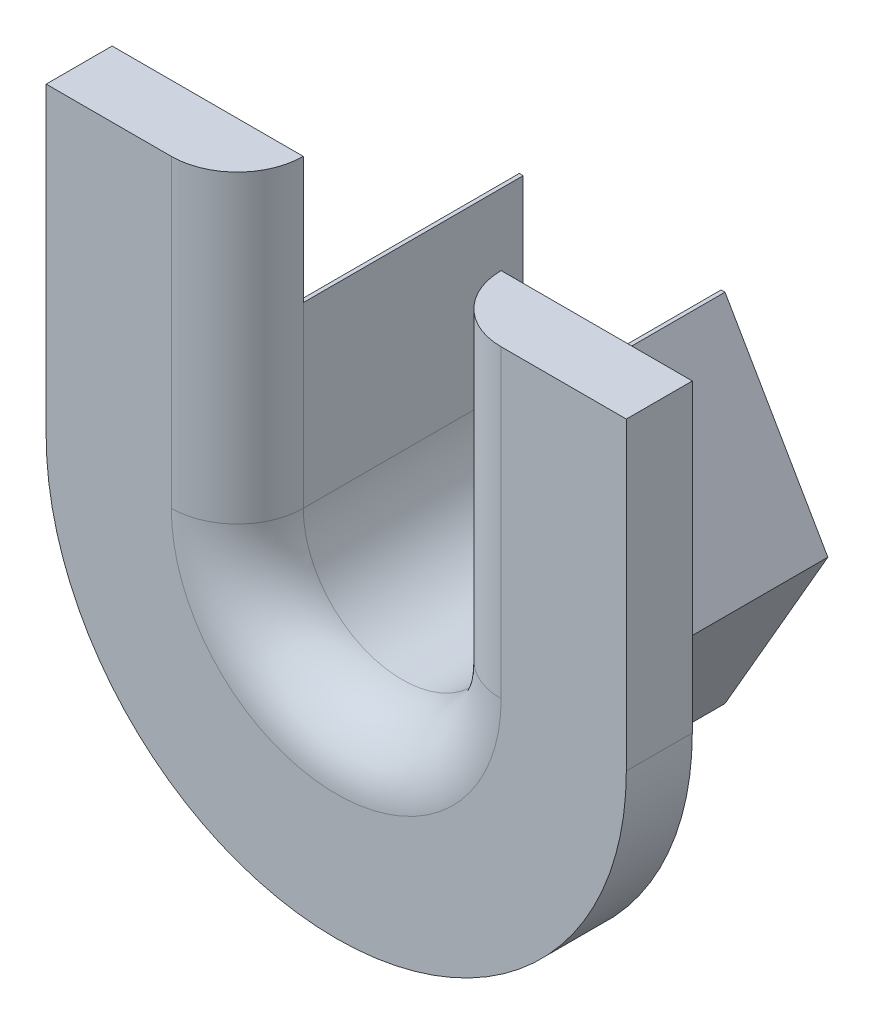
from build123d import *

# Parameters (mm, degrees)
BOSS_EXTRUDE1_DEPTH = 5
BOSS_EXTRUDE2_START = 1.5
BOSS_EXTRUDE2_DEPTH = 1.5
FILLET1_R           = 1.5


with BuildPart() as part:
    # Sketch1 → Boss-Extrude1 (new body)
    with BuildSketch(Plane.XY):
        with BuildLine():
            Line((9.73, -20.13), (9.73, -24.18))
            ThreePointArc((9.73, -24.18), (7.48, -26.43), (5.23, -24.18))
            Line((5.23, -24.18), (5.23, -20.13))
            Line((5.23, -20.13), (5.14173141, -20.13))
            Line((5.14173141, -20.13), (2.80346282, -24.18))
            Line((2.80346282, -24.18), (5.14173141, -28.23))
            Line((5.14173141, -28.23), (9.81826859, -28.23))
            Line((9.81826859, -28.23), (12.15653718, -24.18))
            Line((12.15653718, -24.18), (9.81826859, -20.13))
            Line((9.81826859, -20.13), (9.73, -20.13))
        make_face()
    extrude(amount=-BOSS_EXTRUDE1_DEPTH)

    # Sketch2 → Boss-Extrude2 (add)
    with BuildSketch(Plane.XY.offset(BOSS_EXTRUDE2_START)):
        with BuildLine():
            Line((0.885, -17.25), (0.885, -19.25))
            Line((0.885, -19.25), (0.885, -24.18))
            ThreePointArc((0.885, -24.18), (7.48, -30.775), (14.075, -24.18))
            Line((14.075, -24.18), (14.075, -17.25))
            Line((14.075, -17.25), (10.575, -17.25))
            Line((10.575, -17.25), (9.73, -17.25))
            Line((9.73, -17.25), (9.73, -20.13))
            Line((9.73, -20.13), (9.73, -24.18))
            ThreePointArc((9.73, -24.18), (7.48, -26.43), (5.23, -24.18))
            Line((5.23, -24.18), (5.23, -20.13))
            Line((5.23, -20.13), (5.23, -17.25))
            Line((5.23, -17.25), (0.885, -17.25))
        make_face()
    extrude(amount=-BOSS_EXTRUDE2_DEPTH)

    # Fillet1
    fillet1_edges = [part.edges().sort_by_distance(p)[0] for p in [
        (9.73, -20.715, 1.5),
        (7.48, -26.43, 1.5),
        (5.23, -20.715, 1.5),
    ]]
    fillet(fillet1_edges, radius=FILLET1_R)


solid = part.part
